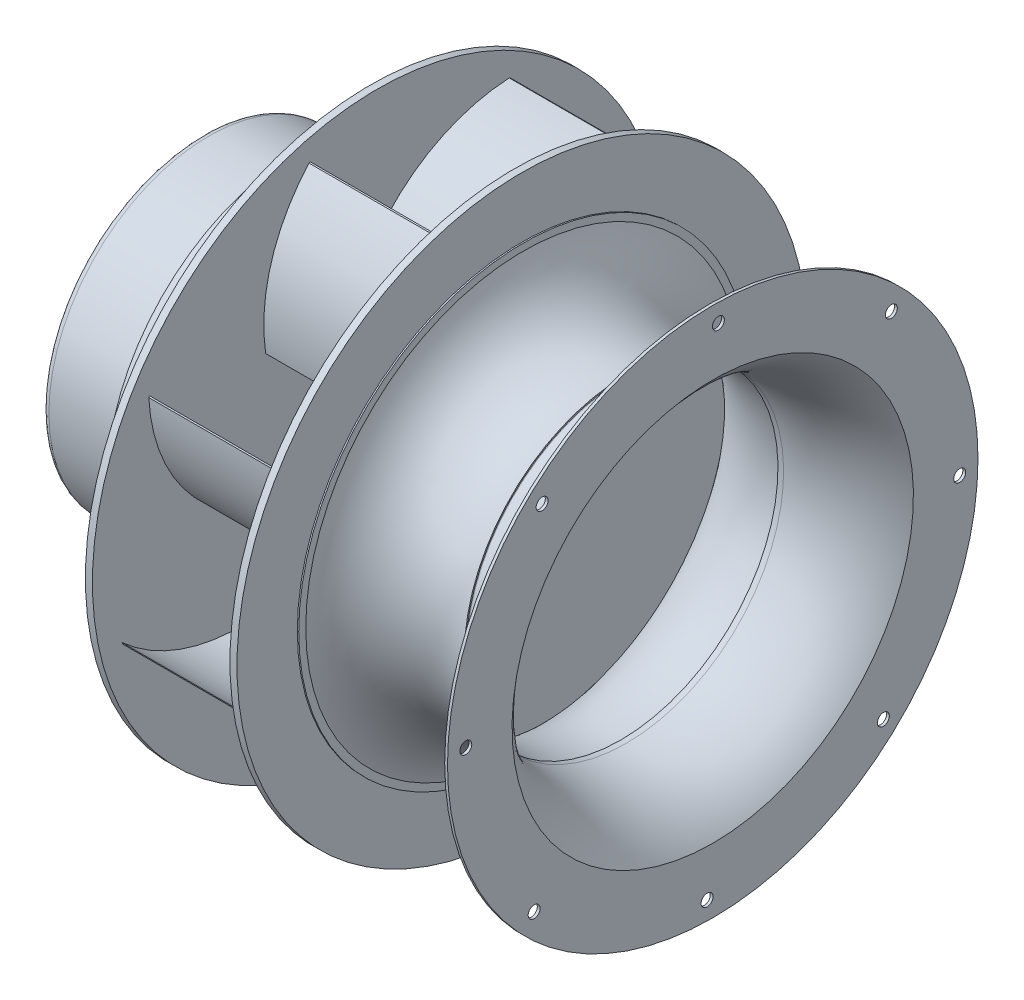
from build123d import *

# Parameters (mm, degrees)
SKETCH2_R         = 203
EXTRUDE1_DEPTH    = 5
SKETCH9_R         = 198
SKETCH9_R_2       = 70
EXTRUDE7_DEPTH    = 3
SKETCH3_R         = 203
EXTRUDE2_DEPTH    = 5
EXTRUDE3_DEPTH    = 103
CIRPATTERN1_COUNT = 8
SKETCH7_R         = 4.25
EXTRUDE5_DEPTH    = 5
SKETCH8_R         = 5
EXTRUDE6_DEPTH    = 83.9
CIRPATTERN3_COUNT = 4


with BuildPart() as part:
    # Sketch1 → Revolve1 (revolve)
    with BuildSketch(Plane.XY, mode=Mode.PRIVATE) as revolve1_sk:
        with BuildLine():
            Line((0, 0), (0, 109))
            ThreePointArc((0, 109), (1.464466094, 112.535533906), (5, 114))
            Line((5, 114), (70, 114))
            Line((70, 114), (70, 138))
            Line((70, 138), (83.9, 138))
            Line((83.9, 138), (83.9, 98))
            Line((83.9, 98), (88.9, 98))
            Line((88.9, 98), (88.9, 133))
            Line((88.9, 133), (98.9, 133))
            Line((98.9, 133), (98.9, 98))
            Line((98.9, 98), (120, 98))
            Line((120, 98), (120, 0))
            Line((120, 0), (0, 0))
        make_face()
    revolve(revolve1_sk.sketch.rotate(Axis((0, 0, 0), (1, 0, 0)), 90), axis=Axis((0, 0, 0), (1, 0, 0)))

    # Sketch2 → Extrude1 (add)
    with BuildSketch(Plane(origin=(120, 0, 0), x_dir=(0, 0, -1), z_dir=(1, 0, 0))):
        Circle(SKETCH2_R)
    extrude(amount=EXTRUDE1_DEPTH)

    # Sketch9 → Extrude7 (cut)
    with BuildSketch(Plane.ZY.offset(-120)):
        Circle(SKETCH9_R)
        Circle(SKETCH9_R_2, mode=Mode.SUBTRACT)
    extrude(amount=-EXTRUDE7_DEPTH, mode=Mode.SUBTRACT)



with BuildPart() as body_2:
    # Sketch3 → Extrude2 (new body)
    with BuildSketch(Plane(origin=(223, 0, 0), x_dir=(0, 0, -1), z_dir=(1, 0, 0))):
        Circle(SKETCH3_R)
    extrude(amount=EXTRUDE2_DEPTH)


with BuildPart() as part_1:
    add(part.part)

    add(body_2.part)  # Extrude3 merges body 2
    # Sketch4 → Extrude3 (add)
    with BuildSketch(Plane(origin=(125, 0, 0), x_dir=(0, 0, -1), z_dir=(1, 0, 0))):
        with BuildLine():
            Line((0, 112.5), (0.866025404, 112))
            ThreePointArc((0.866025404, 112), (42.232799341, 147.681015951), (94.866025404, 162.312775911))
            Line((94.866025404, 162.312775911), (94, 162.812775911))
            ThreePointArc((94, 162.812775911), (41.366773937, 148.181015951), (0, 112.5))
        make_face()
    extrude3 = extrude(amount=EXTRUDE3_DEPTH)

    # CirPattern1: Extrude3 ×8 about axis
    cirpattern1_axis = Axis((0, 0, 0), (1, 0, 0))
    for i in range(1, CIRPATTERN1_COUNT):
        add(extrude3.rotate(cirpattern1_axis, i * 360 / CIRPATTERN1_COUNT))

    # Sketch5 → Revolve2 (revolve)
    with BuildSketch(Plane.XY, mode=Mode.PRIVATE) as revolve2_sk:
        with BuildLine():
            Line((228, 160), (229, 160))
            Line((229, 160), (229, 155))
            ThreePointArc((229, 155), (257.435414382, 120.282131247), (302, 115))
            Line((302, 115), (302, 114))
            ThreePointArc((302, 114), (256.544459127, 119.238779888), (228, 155))
            Line((228, 155), (228, 160))
        make_face()
    revolve(revolve2_sk.sketch.rotate(Axis((0, 0, 0), (1, 0, 0)), 90), axis=Axis((0, 0, 0), (1, 0, 0)))

    # Sketch8 → Extrude6 (cut)
    with BuildSketch(Plane(origin=(0, 0, 0), x_dir=(0, 0, -1), z_dir=(1, 0, 0))):
        with Locations(Location((0, 126, 0), (0, 0, 180))):
            Circle(SKETCH8_R)
    extrude6 = extrude(amount=EXTRUDE6_DEPTH, mode=Mode.SUBTRACT)

    # CirPattern3: Extrude6 ×4 about axis
    cirpattern3_axis = Axis((0, 0, 0), (1, 0, 0))
    for i in range(1, CIRPATTERN3_COUNT):
        add(extrude6.rotate(cirpattern3_axis, i * 360 / CIRPATTERN3_COUNT), mode=Mode.SUBTRACT)


with BuildPart() as body_2_2:
    # Sketch6 → Revolve3 (revolve)
    with BuildSketch(Plane.XY, mode=Mode.PRIVATE) as revolve3_sk:
        with BuildLine():
            Line((364, 189), (362, 189))
            Line((362, 189), (362, 143))
            ThreePointArc((362, 143), (335.389923552, 122.057743057), (302.5, 114))
            Line((302.5, 114), (298.5, 114))
            Line((298.5, 114), (298.5, 112))
            Line((298.5, 112), (302.5, 112))
            ThreePointArc((302.5, 112), (336.756698542, 120.54316257), (364, 143))
            Line((364, 143), (364, 189))
        make_face()
    revolve(revolve3_sk.sketch.rotate(Axis((0, 0, 0), (1, 0, 0)), 180), axis=Axis((0, 0, 0), (1, 0, 0)))

    # Sketch7 → Extrude5 (cut)
    with BuildSketch(Plane(origin=(364, 0, 0), x_dir=(0, 0, -1), z_dir=(1, 0, 0))):
        with Locations((-121.571048537, 127.265392616)):
            Circle(SKETCH7_R)
        with Locations((4.026509313, 175.953934945)):
            Circle(SKETCH7_R)
        with Locations((127.265392616, 121.571048537)):
            Circle(SKETCH7_R)
        with Locations((175.953934945, -4.026509313)):
            Circle(SKETCH7_R)
        with Locations((121.571048537, -127.265392616)):
            Circle(SKETCH7_R)
        with Locations((-4.026509313, -175.953934945)):
            Circle(SKETCH7_R)
        with Locations((-127.265392616, -121.571048537)):
            Circle(SKETCH7_R)
        with Locations((-175.953934945, 4.026509313)):
            Circle(SKETCH7_R)
    extrude(amount=-EXTRUDE5_DEPTH, mode=Mode.SUBTRACT)


solid = Compound([part_1.part, body_2_2.part])
